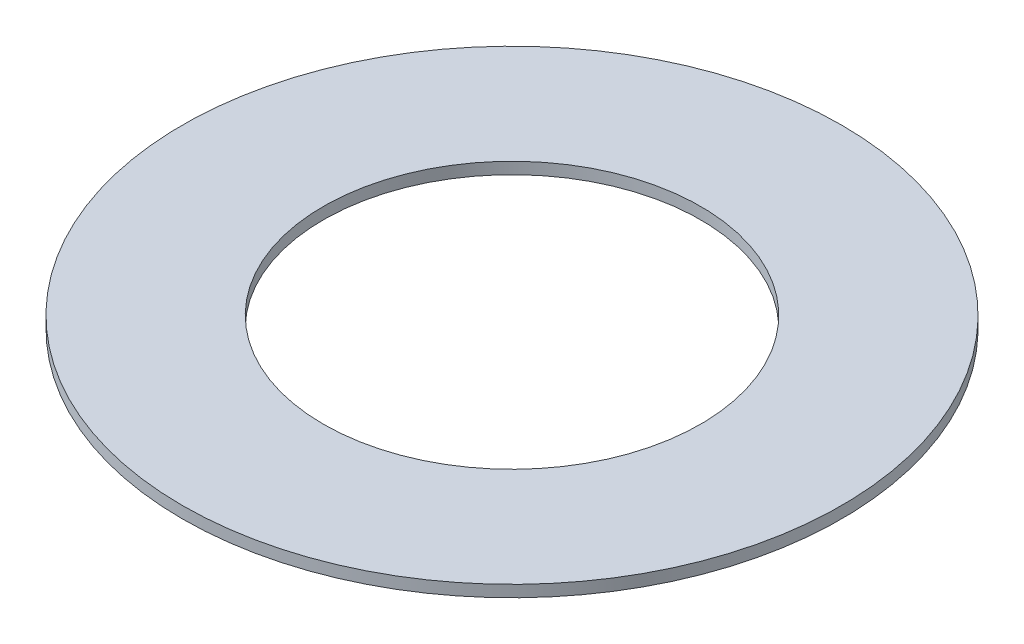
from build123d import *

# Parameters (mm, degrees)
SKETCH1_R           = 14.15
SKETCH1_R_2         = 8.1
BOSS_EXTRUDE1_DEPTH = 0.5


with BuildPart() as part:
    # Sketch1 → Boss-Extrude1 (new body)
    with BuildSketch(Plane(origin=(0, 0, 0), x_dir=(1, 0, 0), z_dir=(0, 1, 0))):
        with Locations(Location((0, 0, 0), (0, 0, 270))):
            Circle(SKETCH1_R)
        with Locations(Location((0, 0, 0), (0, 0, 270))):
            Circle(SKETCH1_R_2, mode=Mode.SUBTRACT)
    extrude(amount=BOSS_EXTRUDE1_DEPTH)


solid = part.part
